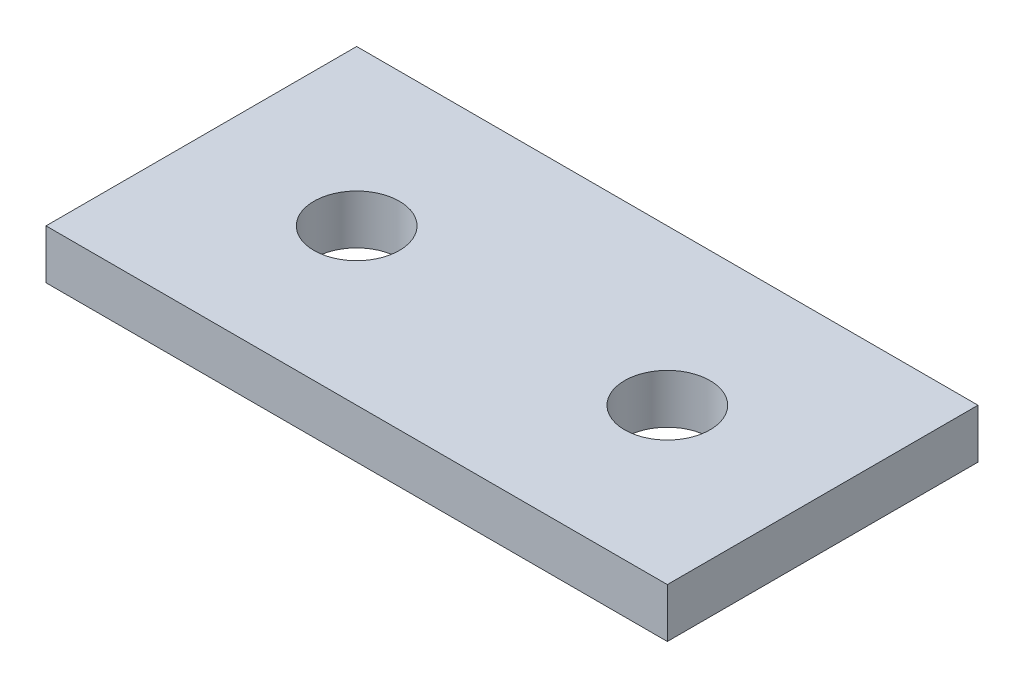
from build123d import *

# Parameters (mm, degrees)
SKETCH1_W           = 40
SKETCH1_H           = 20
SKETCH1_R           = 2.75
BOSS_EXTRUDE1_DEPTH = 3.175


with BuildPart() as part:
    # Sketch1 → Boss-Extrude1 (new body)
    with BuildSketch(Plane(origin=(0, 0, 0), x_dir=(1, 0, 0), z_dir=(0, 1, 0))):
        Rectangle(SKETCH1_W, SKETCH1_H)
        with Locations(Location((-10, 0, 0), (0, 0, 270))):
            Circle(SKETCH1_R, mode=Mode.SUBTRACT)
        with Locations(Location((10, 0, 0), (0, 0, 270))):
            Circle(SKETCH1_R, mode=Mode.SUBTRACT)
    extrude(amount=BOSS_EXTRUDE1_DEPTH)


solid = part.part
